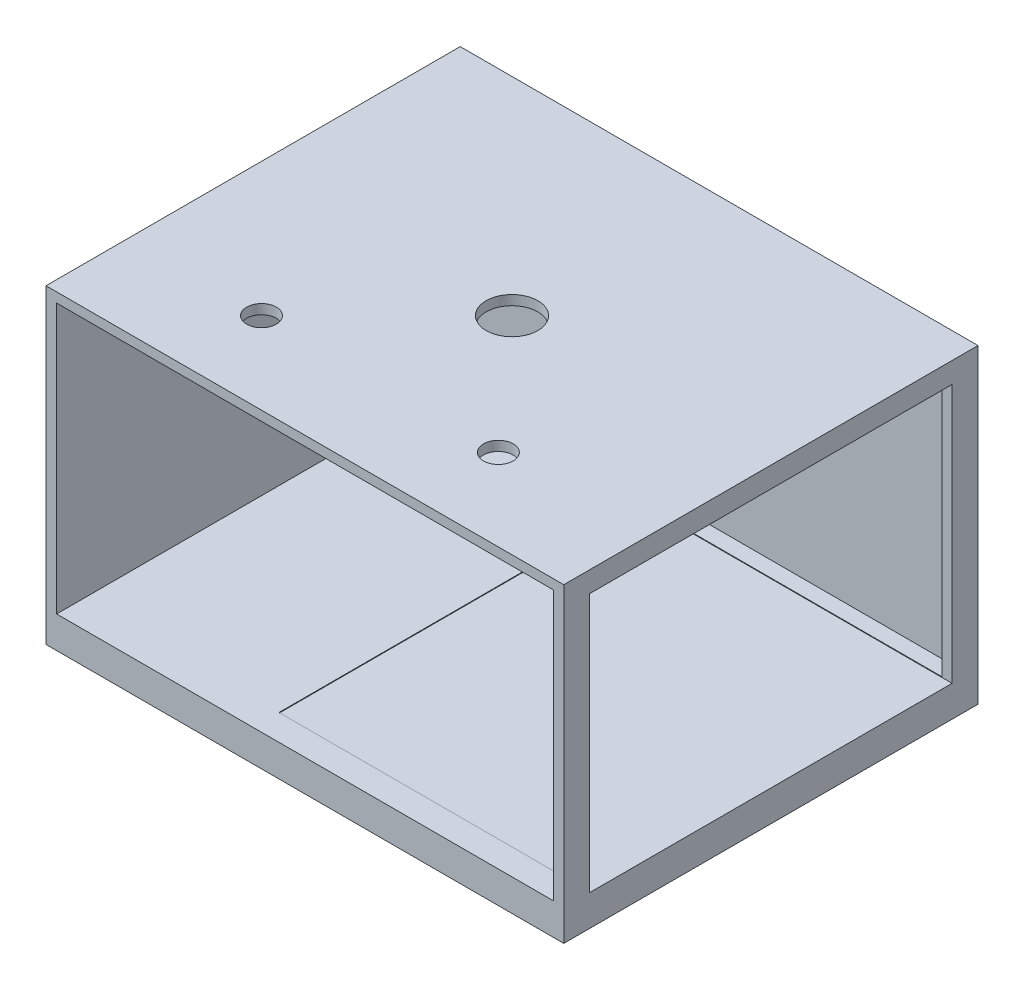
from build123d import *

# Parameters (mm, degrees)
SKETCH1_W                 = 375
SKETCH1_H                 = 10.632083078
BOSS_EXTRUDE1_DEPTH       = 9.738944775
SKETCH2_W                 = 9.738944775
SKETCH2_H                 = 25
BOSS_EXTRUDE2_DEPTH       = 249.367916922
BOSS_EXTRUDE3_DEPTH       = 0.632083078
SKETCH4_W                 = 489.738944775
SKETCH4_H                 = 375
BOSS_EXTRUDE4_DEPTH       = 30
SKETCH5_W                 = 489.738944775
SKETCH5_H                 = 290.632083078
BOSS_EXTRUDE5_DEPTH       = 25
SKETCH6_W                 = 400
SKETCH6_H                 = 290.632083078
BOSS_EXTRUDE6_DEPTH       = 10.261055225
SKETCH7_W                 = 500
SKETCH7_H                 = 400
BOSS_EXTRUDE7_DEPTH       = 9.367916922
SKETCH8_W                 = 480
SKETCH8_H                 = 260
CUT_EXTRUDE1_DEPTH        = 15
M25_CLEARANCE_HOLE1_D     = 28.660544953
M25_CLEARANCE_HOLE1_DEPTH = 9.367916922
M45_CLEARANCE_HOLE1_D     = 50
M45_CLEARANCE_HOLE1_DEPTH = 9.367916922


with BuildPart() as part:
    # Sketch1 → Boss-Extrude1 (new body)
    with BuildSketch(Plane(origin=(250, 0, 0), x_dir=(0, 0, -1), z_dir=(1, 0, 0))):
        with Locations((-12.5, 285.316041539)):
            Rectangle(SKETCH1_W, SKETCH1_H)
    extrude(amount=-BOSS_EXTRUDE1_DEPTH)

    # Sketch2 → Boss-Extrude2 (add)
    with BuildSketch(Plane.XZ.offset(-280)):
        with Locations((245.130527613, 187.5)):
            Rectangle(SKETCH2_W, SKETCH2_H)
    extrude(amount=BOSS_EXTRUDE2_DEPTH)

    # Sketch3 → Boss-Extrude3 (add)
    with BuildSketch(Plane.XZ.offset(-30.632083078)):
        Polygon((-50, 175), (-50, -175), (-239.738944775, -175), (-239.738944775, 200), (250, 200), (250, 175), align=None)
    extrude(amount=BOSS_EXTRUDE3_DEPTH)

    # Sketch4 → Boss-Extrude4 (add)
    with BuildSketch(Plane.XZ.offset(-30)):
        with Locations((5.130527613, 12.5)):
            Rectangle(SKETCH4_W, SKETCH4_H)
    extrude(amount=BOSS_EXTRUDE4_DEPTH)

    # Sketch5 → Boss-Extrude5 (add)
    with BuildSketch(Plane(origin=(0, 0, -175), x_dir=(-1, 0, 0), z_dir=(0, 0, -1))):
        with Locations((-5.130527613, 145.316041539)):
            Rectangle(SKETCH5_W, SKETCH5_H)
    extrude(amount=BOSS_EXTRUDE5_DEPTH)

    # Sketch6 → Boss-Extrude6 (add)
    with BuildSketch(Plane.ZY.offset(239.738944775)):
        with Locations((0, 145.316041539)):
            Rectangle(SKETCH6_W, SKETCH6_H)
    extrude(amount=BOSS_EXTRUDE6_DEPTH)

    # Sketch7 → Boss-Extrude7 (add)
    with BuildSketch(Plane(origin=(0, 290.632083078, 0), x_dir=(-1, 0, 0), z_dir=(0, 1, 0))):
        Rectangle(SKETCH7_W, SKETCH7_H)
    extrude(amount=BOSS_EXTRUDE7_DEPTH)

    # Sketch8 → Cut-Extrude1 (cut)
    with BuildSketch(Plane.XY.offset(-175)):
        with Locations((0.261055225, 160.632083078)):
            Rectangle(SKETCH8_W, SKETCH8_H)
    extrude(amount=-CUT_EXTRUDE1_DEPTH, mode=Mode.SUBTRACT)

    # M25 Clearance Hole1
    with Locations(Plane(origin=(0, 290.632083078, 0), x_dir=(-1, 0, 0), z_dir=(0, -1, 0))):
        with Locations((-107.763649025, -120.947499703), (120.947499703, -120.947499703)):
            Hole(M25_CLEARANCE_HOLE1_D / 2, depth=M25_CLEARANCE_HOLE1_DEPTH)

    # M45 Clearance Hole1
    with Locations(Plane(origin=(0, 290.632083078, 0), x_dir=(-1, 0, 0), z_dir=(0, -1, 0))):
        with Locations((0, 0)):
            Hole(M45_CLEARANCE_HOLE1_D / 2, depth=M45_CLEARANCE_HOLE1_DEPTH)


solid = part.part
